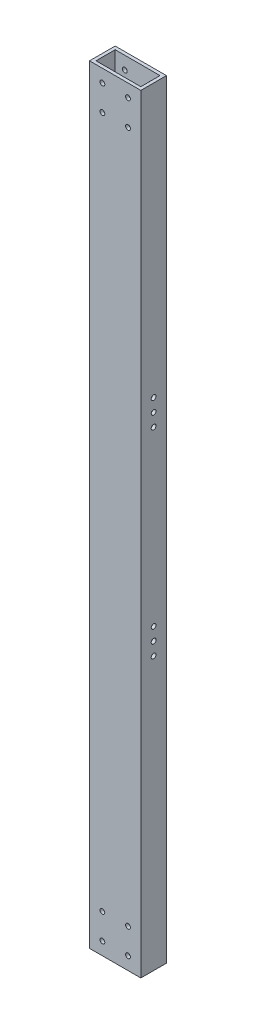
from build123d import *

# Parameters (mm, degrees)
SKETCH1_W               = 50.8
SKETCH1_H               = 25.4
BOSS_EXTRUDE1_DEPTH     = 381
SHELL1_T                = -3.175
SKETCH4_R               = 2.38125
CUT_EXTRUDE1_DEPTH      = 385.581499815
CUT_EXTRUDE2_DEPTH      = 383.689587002
CUT_EXTRUDE2_DEPTH_BACK = 383.689587002
SKETCH5_R               = 2.38125


with BuildPart() as part:
    # Sketch1 → Boss-Extrude1 (new, symmetric)
    with BuildSketch(Plane(origin=(0, 0, 0), x_dir=(1, 0, 0), z_dir=(0, 1, 0))):
        Rectangle(SKETCH1_W, SKETCH1_H)
    extrude(amount=BOSS_EXTRUDE1_DEPTH, both=True)

    # Shell1
    shell1_openings = [part.faces().sort_by_distance(p)[0] for p in [
        (0, 381, 0),
        (0, -381, 0),
    ]]
    offset(amount=SHELL1_T, openings=shell1_openings, kind=Kind.INTERSECTION)

    # Sketch4 → Cut-Extrude1 (cut, through all)
    with BuildSketch(Plane(origin=(25.4, 0, 0), x_dir=(0, 0, -1), z_dir=(1, 0, 0))):
        with Locations((0, 110.9345)):
            Circle(SKETCH4_R)
        with Locations((0, 98.2345)):
            Circle(SKETCH4_R)
        with Locations((0, 85.5345)):
            Circle(SKETCH4_R)
        with Locations(Location((0, -85.5345, 0), (0, 0, 180))):
            Circle(SKETCH4_R)
        with Locations(Location((0, -98.2345, 0), (0, 0, 180))):
            Circle(SKETCH4_R)
        with Locations(Location((0, -110.9345, 0), (0, 0, 180))):
            Circle(SKETCH4_R)
    extrude(amount=-CUT_EXTRUDE1_DEPTH, mode=Mode.SUBTRACT)

    # Sketch5 → Cut-Extrude2 (cut, two sides: drawn at the far end of the back side and taken through both)
    with BuildSketch(Plane.XY.offset(12.7).offset(-CUT_EXTRUDE2_DEPTH_BACK)):
        with Locations((-12.7, 368.3)):
            Circle(SKETCH5_R)
        with Locations((12.7, 368.3)):
            Circle(SKETCH5_R)
        with Locations((12.7, 342.9)):
            Circle(SKETCH5_R)
        with Locations((-12.7, 342.9)):
            Circle(SKETCH5_R)
        with Locations((-12.7, -342.9)):
            Circle(SKETCH5_R)
        with Locations((12.7, -342.9)):
            Circle(SKETCH5_R)
        with Locations((12.7, -368.3)):
            Circle(SKETCH5_R)
        with Locations((-12.7, -368.3)):
            Circle(SKETCH5_R)
    extrude(amount=CUT_EXTRUDE2_DEPTH + CUT_EXTRUDE2_DEPTH_BACK, mode=Mode.SUBTRACT)


solid = part.part
